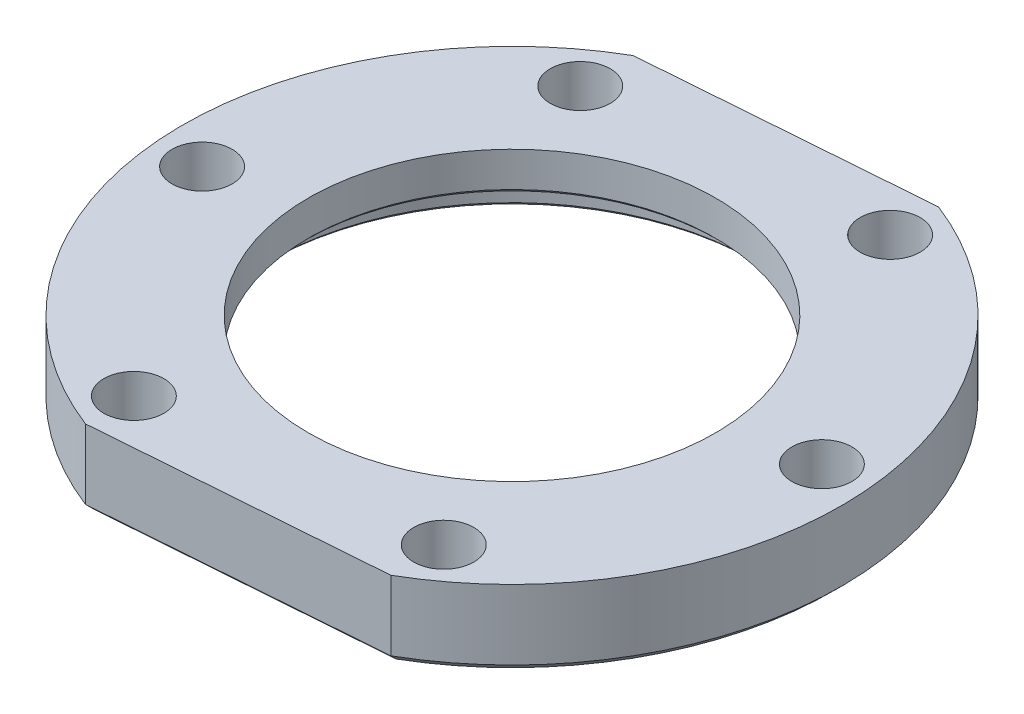
from build123d import *

# Parameters (mm, degrees)
SKETCH1_R           = 17
SKETCH1_R_2         = 12.5
BOSS_EXTRUDE1_DEPTH = 4
SKETCH2_R           = 1.55
CUT_EXTRUDE1_DEPTH  = 25.372115214
BOSS_EXTRUDE2_START = -2
SKETCH3_R           = 12.5
SKETCH3_R_2         = 10.5
BOSS_EXTRUDE2_DEPTH = 2
CHAMFER1_SIZE       = 0.2
CHAMFER2_SIZE       = 0.4


with BuildPart() as part:
    # Sketch1 → Boss-Extrude1 (new body)
    with BuildSketch(Plane(origin=(0, 0, 0), x_dir=(1, 0, 0), z_dir=(0, 1, 0))):
        with Locations(Location((0, 0, 0), (0, 0, 270))):
            Circle(SKETCH1_R)
        with Locations(Location((0, 0, 0), (0, 0, 270))):
            Circle(SKETCH1_R_2, mode=Mode.SUBTRACT)
    extrude(amount=BOSS_EXTRUDE1_DEPTH)

    # Sketch2 → Cut-Extrude1 (cut, through all)
    with BuildSketch(Plane(origin=(0, 4, 0), x_dir=(1, 0, 0), z_dir=(0, 1, 0))):
        with Locations(Location((-8.485, 12.005347771, 0), (0, 0, 270))):
            Circle(SKETCH2_R)
        with Locations(Location((6.154436151, 13.350899437, 0), (0, 0, 270))):
            Circle(SKETCH2_R)
        with Locations(Location((14.639436151, 1.345551666, 0), (0, 0, 270))):
            Circle(SKETCH2_R)
        with Locations(Location((8.485, -12.005347771, 0), (0, 0, 270))):
            Circle(SKETCH2_R)
        with Locations(Location((-6.154436151, -13.350899437, 0), (0, 0, 270))):
            Circle(SKETCH2_R)
        with Locations(Location((-14.639436151, -1.345551666, 0), (0, 0, 270))):
            Circle(SKETCH2_R)
        Polygon((-8.485, 14.731081936), (6.154436151, 15.846858227), (5.945678869, 18.585838188), (-8.485, 17.485972785), align=None)
        Polygon((8.485, -14.731081936), (8.693757282, -17.470061897), (-5.736921587, -18.5699273), (-6.154436151, -15.846858227), align=None)
    extrude(amount=-CUT_EXTRUDE1_DEPTH, mode=Mode.SUBTRACT)

    # Sketch3 → Boss-Extrude2 (add)
    with BuildSketch(Plane(origin=(0, 4, 0), x_dir=(1, 0, 0), z_dir=(0, 1, 0)).offset(BOSS_EXTRUDE2_START)):
        with Locations(Location((0, 0, 0), (0, 0, 270))):
            Circle(SKETCH3_R)
        with Locations(Location((0, 0, 0), (0, 0, 270))):
            Circle(SKETCH3_R_2, mode=Mode.SUBTRACT)
    extrude(amount=BOSS_EXTRUDE2_DEPTH)

    # Chamfer1
    chamfer1_edges = [part.edges().sort_by_distance(p)[0] for p in [
        (0, 0, -12.5),
        (0, 2, -12.5),
        (0, 2, -10.5),
    ]]
    chamfer(chamfer1_edges, length=CHAMFER1_SIZE)

    # Chamfer2
    chamfer2_edges = [part.edges().sort_by_distance(p)[0] for p in [
        (-16.950837114, 0, 1.291944715),
        (16.950837114, 0, -1.291944715),
        (-1.165281924, 0, -15.288970081),
        (1.165281924, 0, 15.288970081),
    ]]
    chamfer(chamfer2_edges, length=CHAMFER2_SIZE)


solid = part.part
